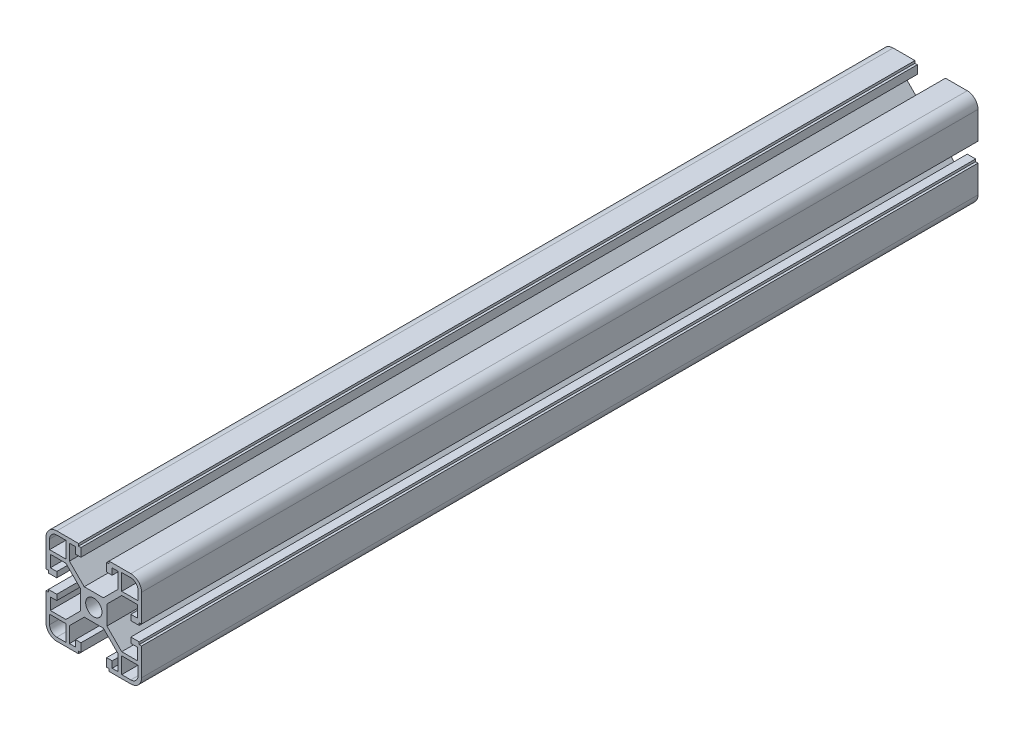
from build123d import *
from build123d.topology import SkipClean

# Parameters (mm, degrees)
BOSS_EXTRUDE1_DEPTH  = 350
MIRROR3_COPY_1_DEPTH = 350
MIRROR3_COPY_2_DEPTH = 350


with BuildPart() as part:
    # Sketch1 → Boss-Extrude1 (new body)
    with BuildSketch(Plane.XY):
        with BuildLine():
            Line((3.4, 0), (5.5, 0))
            Line((5.5, 0), (5.5, 4))
            Line((5.5, 4), (11.69, 10.19))
            Line((11.69, 10.19), (18.2, 10.19))
            Line((18.2, 10.19), (18.2, 5.265595036))
            Line((18.2, 5.265595036), (15.5, 5.265595036))
            Line((15.5, 5.265595036), (15.5, 2.965595036))
            Line((15.5, 2.965595036), (19, 2.965595036))
            Line((19, 2.965595036), (19, 3.965595036))
            Line((19, 3.965595036), (20, 3.965595036))
            Line((20, 3.965595036), (20, 15.5))
            ThreePointArc((20, 15.5), (18.681980515, 18.681980515), (15.5, 20))
            Line((15.5, 20), (6.385304712, 20))
            Line((6.385304712, 20), (6.385304712, 19))
            Line((6.385304712, 19), (5.385304712, 19))
            Line((5.385304712, 19), (5.385304712, 15.5))
            Line((5.385304712, 15.5), (7.685304712, 15.5))
            Line((7.685304712, 15.5), (7.685304712, 18.2))
            Line((7.685304712, 18.2), (10.19, 18.2))
            Line((10.19, 18.2), (10.19, 11.69))
            Line((10.19, 11.69), (4, 5.5))
            Line((4, 5.5), (0, 5.5))
            Line((0, 5.5), (0, 3.4))
            ThreePointArc((0, 3.4), (2.404163056, 2.404163056), (3.4, 0))
        make_face()
        with BuildLine():
            Line((18.5, 11.69), (18.5, 15.5))
            ThreePointArc((18.5, 15.5), (17.621320344, 17.621320344), (15.5, 18.5))
            Line((15.5, 18.5), (11.69, 18.5))
            Line((11.69, 18.5), (11.69, 11.69))
            Line((11.69, 11.69), (18.5, 11.69))
        make_face(mode=Mode.SUBTRACT)
    boss_extrude1 = extrude(amount=BOSS_EXTRUDE1_DEPTH)

    # Mirror1: Boss-Extrude1 across plane
    add(boss_extrude1.mirror(Plane.ZX))

    # Mirror2: Boss-Extrude1 across plane
    add(boss_extrude1.mirror(Plane(origin=(0, 0, 0), x_dir=(0, 0, 1), z_dir=(1, 0, 0))))

    # Mirror3 copy 1 sketch → Mirror3 copy 1 (add)
    with BuildSketch(Plane(origin=(0, 0, 0), x_dir=(-1, 0, 0), z_dir=(0, 0, 1))):
        with BuildLine():
            Line((3.4, 0), (5.5, 0))
            Line((5.5, 0), (5.5, 4))
            Line((5.5, 4), (11.69, 10.19))
            Line((11.69, 10.19), (18.2, 10.19))
            Line((18.2, 10.19), (18.2, 5.265595036))
            Line((18.2, 5.265595036), (15.5, 5.265595036))
            Line((15.5, 5.265595036), (15.5, 2.965595036))
            Line((15.5, 2.965595036), (19, 2.965595036))
            Line((19, 2.965595036), (19, 3.965595036))
            Line((19, 3.965595036), (20, 3.965595036))
            Line((20, 3.965595036), (20, 15.5))
            ThreePointArc((20, 15.5), (18.681980515, 18.681980515), (15.5, 20))
            Line((15.5, 20), (6.385304712, 20))
            Line((6.385304712, 20), (6.385304712, 19))
            Line((6.385304712, 19), (5.385304712, 19))
            Line((5.385304712, 19), (5.385304712, 15.5))
            Line((5.385304712, 15.5), (7.685304712, 15.5))
            Line((7.685304712, 15.5), (7.685304712, 18.2))
            Line((7.685304712, 18.2), (10.19, 18.2))
            Line((10.19, 18.2), (10.19, 11.69))
            Line((10.19, 11.69), (4, 5.5))
            Line((4, 5.5), (0, 5.5))
            Line((0, 5.5), (0, 3.4))
            ThreePointArc((0, 3.4), (2.404163056, 2.404163056), (3.4, 0))
        make_face()
        with BuildLine():
            Line((18.5, 11.69), (18.5, 15.5))
            ThreePointArc((18.5, 15.5), (17.621320344, 17.621320344), (15.5, 18.5))
            Line((15.5, 18.5), (11.69, 18.5))
            Line((11.69, 18.5), (11.69, 11.69))
            Line((11.69, 11.69), (18.5, 11.69))
        make_face(mode=Mode.SUBTRACT)
    extrude(amount=MIRROR3_COPY_1_DEPTH)

    # Mirror3 copy 2 sketch → Mirror3 copy 2 (add)
    with SkipClean():  # the faces are left unmerged after this step: merging them gives an invalid solid
        with BuildSketch(Plane.XY):
            with BuildLine():
                Line((3.4, 0), (5.5, 0))
                Line((5.5, 0), (5.5, -4))
                Line((5.5, -4), (11.69, -10.19))
                Line((11.69, -10.19), (18.2, -10.19))
                Line((18.2, -10.19), (18.2, -5.265595036))
                Line((18.2, -5.265595036), (15.5, -5.265595036))
                Line((15.5, -5.265595036), (15.5, -2.965595036))
                Line((15.5, -2.965595036), (19, -2.965595036))
                Line((19, -2.965595036), (19, -3.965595036))
                Line((19, -3.965595036), (20, -3.965595036))
                Line((20, -3.965595036), (20, -15.5))
                ThreePointArc((20, -15.5), (18.681980515, -18.681980515), (15.5, -20))
                Line((15.5, -20), (6.385304712, -20))
                Line((6.385304712, -20), (6.385304712, -19))
                Line((6.385304712, -19), (5.385304712, -19))
                Line((5.385304712, -19), (5.385304712, -15.5))
                Line((5.385304712, -15.5), (7.685304712, -15.5))
                Line((7.685304712, -15.5), (7.685304712, -18.2))
                Line((7.685304712, -18.2), (10.19, -18.2))
                Line((10.19, -18.2), (10.19, -11.69))
                Line((10.19, -11.69), (4, -5.5))
                Line((4, -5.5), (0, -5.5))
                Line((0, -5.5), (0, -3.4))
                ThreePointArc((0, -3.4), (2.404163056, -2.404163056), (3.4, 0))
            make_face()
            with BuildLine():
                Line((18.5, -11.69), (18.5, -15.5))
                ThreePointArc((18.5, -15.5), (17.621320344, -17.621320344), (15.5, -18.5))
                Line((15.5, -18.5), (11.69, -18.5))
                Line((11.69, -18.5), (11.69, -11.69))
                Line((11.69, -11.69), (18.5, -11.69))
            make_face(mode=Mode.SUBTRACT)
        extrude(amount=MIRROR3_COPY_2_DEPTH)


solid = part.part
